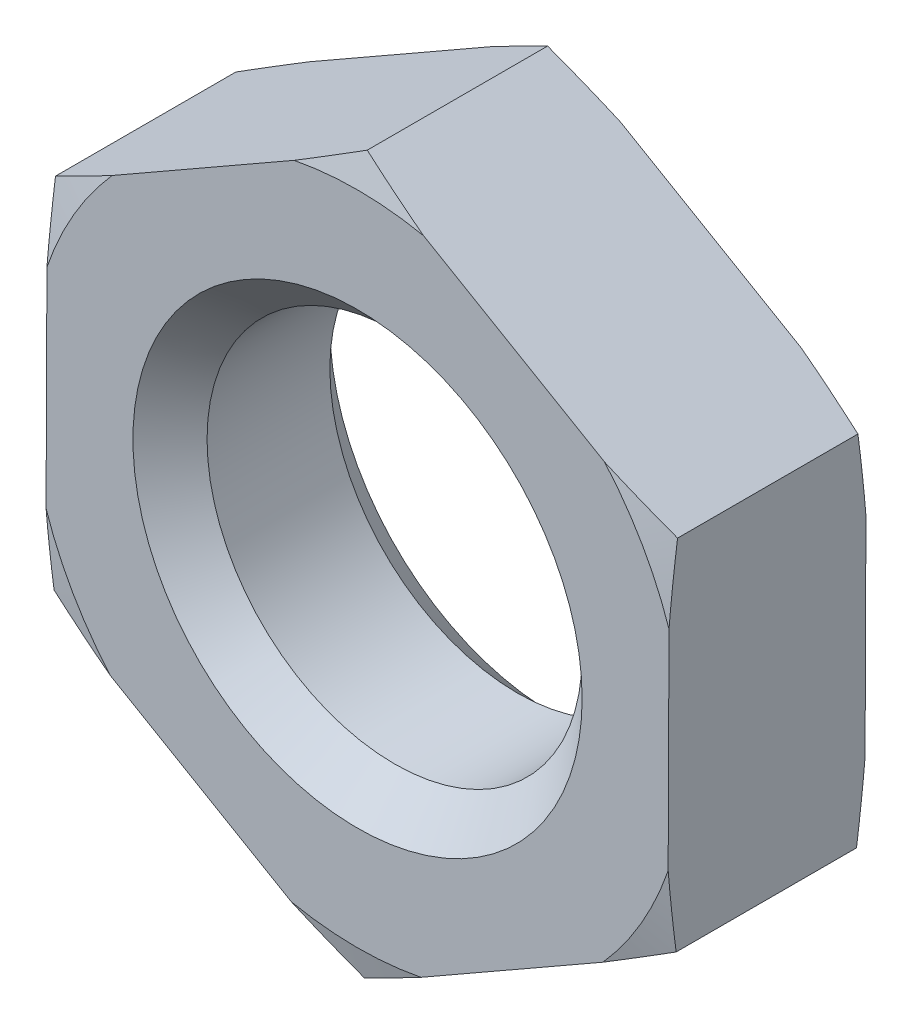
from build123d import *

# Parameters (mm, degrees)
SKETCH_1_R          = 2
EXTRUDE_537_DEPTH   = 2.1
SKETCH_2_OUTSIDE_W  = 59.154
SKETCH_2_OUTSIDE_H  = 60.166
SKETCH_2_OUTSIDE_R  = 3.5
CUT_EXTRUDE_1_DEPTH = 6.489098798
CUT_EXTRUDE_1_DRAFT = -75
SKETCH_3_OUTSIDE_W  = 59.154
SKETCH_3_OUTSIDE_H  = 60.166
SKETCH_3_OUTSIDE_R  = 3.5
CUT_EXTRUDE_2_DEPTH = 6.489098798
CUT_EXTRUDE_2_DRAFT = -75
CHAMFER_1_SIZE      = 0.395238095


with BuildPart() as part:
    # 草图1 → Extrude 537 (new body)
    with BuildSketch(Plane.XY):
        Polygon((0.015065818, 3.829970368), (-3.309318726, 1.928032565), (-3.324384544, -1.901937803), (-0.015065818, -3.829970368), (3.309318726, -1.928032565), (3.324384544, 1.901937803), align=None)
        Circle(SKETCH_1_R, mode=Mode.SUBTRACT)
    extrude(amount=EXTRUDE_537_DEPTH)


with BuildPart() as cut_extrude_1_tool:
    # 草图2 outside → 切除-拉伸1 (with draft: the straight prism first)
    with BuildSketch(Plane(origin=(0, 0, 0), x_dir=(-1, 0, 0), z_dir=(0, 0, -1))):
        Rectangle(SKETCH_2_OUTSIDE_W, SKETCH_2_OUTSIDE_H)
        Circle(SKETCH_2_OUTSIDE_R, mode=Mode.SUBTRACT)
    extrude(amount=-CUT_EXTRUDE_1_DEPTH)
    # 切除-拉伸1: the draft: its side faces are tilted about the plane it starts from
    cut_extrude_1_sides = [cut_extrude_1_tool.faces().sort_by_distance(p)[0] for p in [
        (0, -30.083, 3.244549399),
        (-29.577, 0, 3.244549399),
        (0, 30.083, 3.244549399),
        (29.577, 0, 3.244549399),
        (3.5, 0, 3.244549399),
    ]]
    draft(cut_extrude_1_sides, Plane(origin=(0, 0, 0), x_dir=(-1, 0, 0), z_dir=(0, 0, -1)), CUT_EXTRUDE_1_DRAFT)


with BuildPart() as part_1:
    add(part.part)

    # 切除-拉伸1: cut by cut_extrude_1_tool
    add(cut_extrude_1_tool.part, mode=Mode.SUBTRACT)


with BuildPart() as cut_extrude_2_tool:
    # 草图3 outside → 切除-拉伸2 (with draft: the straight prism first)
    with BuildSketch(Plane.XY.offset(2.1)):
        Rectangle(SKETCH_3_OUTSIDE_W, SKETCH_3_OUTSIDE_H)
        Circle(SKETCH_3_OUTSIDE_R, mode=Mode.SUBTRACT)
    extrude(amount=-CUT_EXTRUDE_2_DEPTH)
    # 切除-拉伸2: the draft: its side faces are tilted about the plane it starts from
    cut_extrude_2_sides = [cut_extrude_2_tool.faces().sort_by_distance(p)[0] for p in [
        (0, -30.083, -1.144549399),
        (29.577, 0, -1.144549399),
        (0, 30.083, -1.144549399),
        (-29.577, 0, -1.144549399),
        (-3.5, 0, -1.144549399),
    ]]
    draft(cut_extrude_2_sides, Plane.XY.offset(2.1), CUT_EXTRUDE_2_DRAFT)


with BuildPart() as part_2:
    add(part_1.part)

    # 切除-拉伸2: cut by cut_extrude_2_tool
    add(cut_extrude_2_tool.part, mode=Mode.SUBTRACT)

    # 倒角1
    chamfer_1_edges = [part_2.edges().sort_by_distance(p)[0] for p in [
        (-2, 0, 0),
        (-2, 0, 2.1),
    ]]
    chamfer(chamfer_1_edges, length=CHAMFER_1_SIZE)


solid = part_2.part
